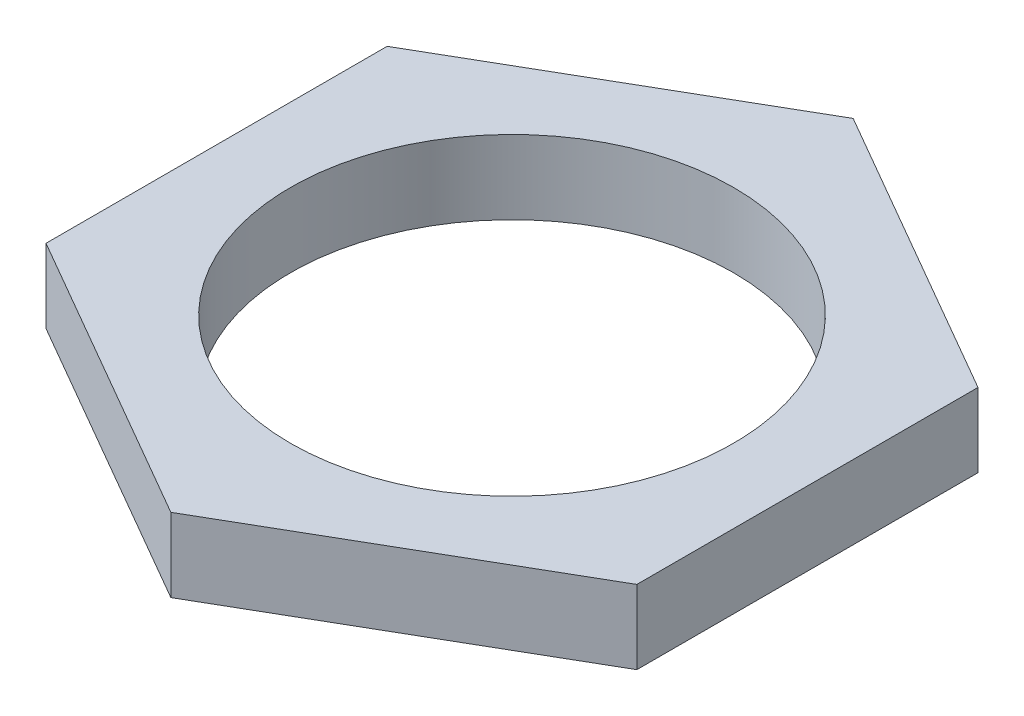
from build123d import *

# Parameters (mm, degrees)
BOSS_EXTRUDE2_DEPTH = 1
CUT_EXTRUDE2_REACH  = 8.191
SKETCH4_R           = 3


with BuildPart() as part:
    # Sketch2 → Boss-Extrude2 (new body)
    with BuildSketch(Plane(origin=(0, 0, 0), x_dir=(1, 0, 0), z_dir=(0, 1, 0))):
        Polygon((0, 4.618802154), (-4, 2.309401077), (-4, -2.309401077), (0, -4.618802154), (4, -2.309401077), (4, 2.309401077), align=None)
    extrude(amount=BOSS_EXTRUDE2_DEPTH)

    # Sketch4 → Cut-Extrude2 (cut, up to next)
    with BuildSketch(Plane(origin=(0, 1, 0), x_dir=(1, 0, 0), z_dir=(0, 1, 0)), mode=Mode.PRIVATE) as cut_extrude2_sk1:
        with Locations(Location((0, 0, 0), (0, 0, 270))):
            Circle(SKETCH4_R)
    cut_extrude2_tool1 = extrude(cut_extrude2_sk1.sketch, amount=-CUT_EXTRUDE2_REACH, mode=Mode.PRIVATE) & part.part
    add(cut_extrude2_tool1.solids().sort_by_distance((0, 1, 0))[0], mode=Mode.SUBTRACT)


solid = part.part
